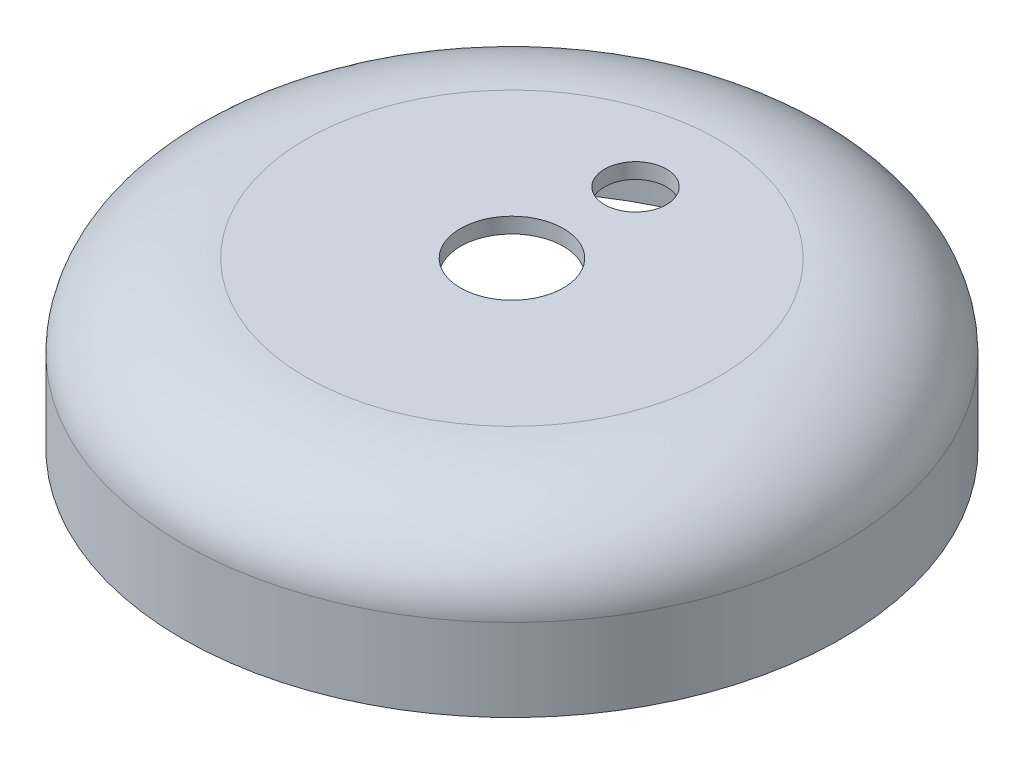
from build123d import *

# Parameters (mm, degrees)
SKETCH2_R          = 9.525
SKETCH2_R_2        = 15.875
CUT_EXTRUDE1_DEPTH = 25.4


with BuildPart() as part:
    # Sketch1 → Revolve1 (revolve)
    with BuildSketch(Plane.XY, mode=Mode.PRIVATE) as revolve1_sk:
        with BuildLine():
            Line((0, 0), (0, -4.7625))
            Line((0, -4.7625), (63.5, -4.7625))
            add(Edge.make_bspline(
                [(96.8375, -25.4), (96.8375, -4.7625), (63.5, -4.7625)],
                knots=[0, 0, 0, 1.570796327, 1.570796327, 1.570796327], degree=2, weights=[1, 0.707106781, 1]))
            Line((96.8375, -25.4), (96.8375, -50.8))
            Line((96.8375, -50.8), (101.6, -50.8))
            Line((101.6, -50.8), (101.6, -25.4))
            add(Edge.make_bspline(
                [(101.6, -25.4), (101.6, 0), (63.5, 0)],
                knots=[3.141592654, 3.141592654, 3.141592654, 4.71238898, 4.71238898, 4.71238898], degree=2, weights=[1, 0.707106781, 1]))
            Line((63.5, 0), (0, 0))
        make_face()
    revolve(revolve1_sk.sketch.rotate(Axis((0, 29.511089747, 0), (0, -1, 0)), 90), axis=Axis((0, 29.511089747, 0), (0, -1, 0)))

    # Sketch2 → Cut-Extrude1 (cut)
    with BuildSketch(Plane(origin=(0, 0, 0), x_dir=(1, 0, 0), z_dir=(0, 1, 0))):
        with Locations(Location((0, 38.1, 0), (0, 0, 270))):
            Circle(SKETCH2_R)
        with Locations(Location((0, 0, 0), (0, 0, 270))):
            Circle(SKETCH2_R_2)
    extrude(amount=-CUT_EXTRUDE1_DEPTH, mode=Mode.SUBTRACT)


solid = part.part
